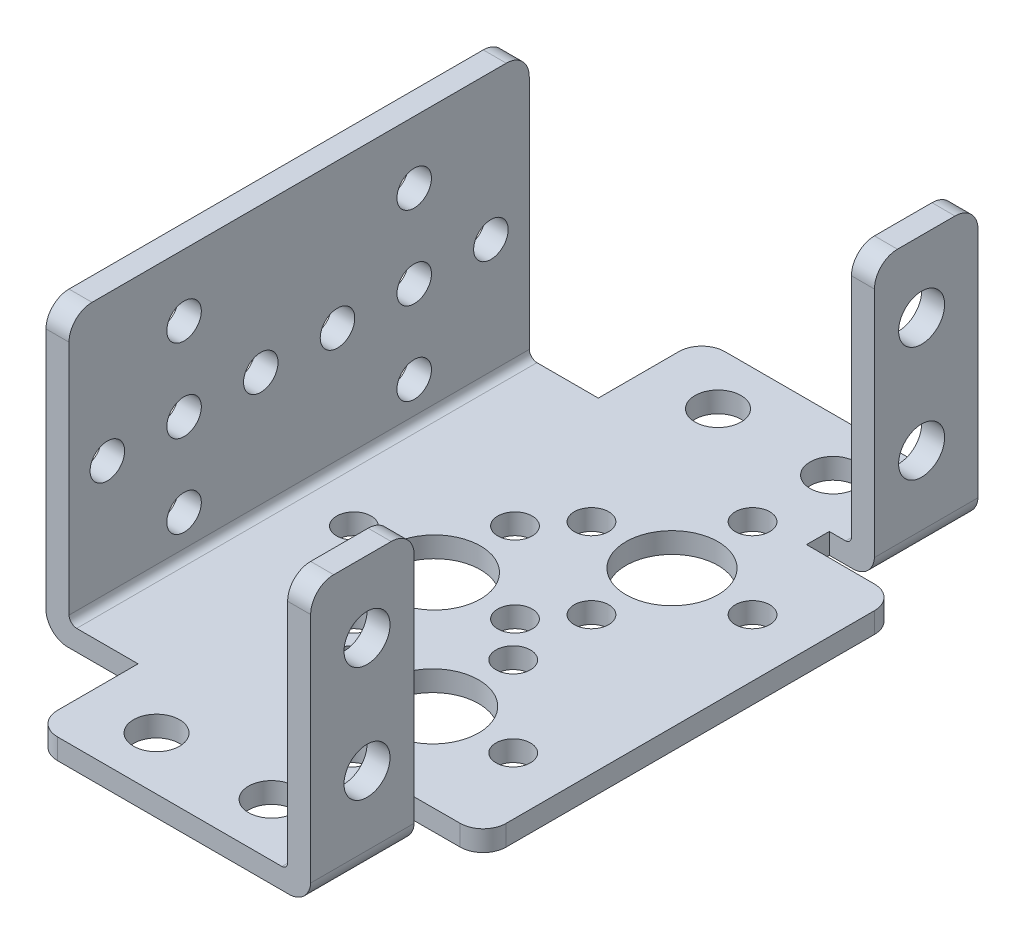
from build123d import *

# Parameters (mm, degrees)
BOSS_EXTRUDE1_DEPTH  = 40
FILLET1_R            = 2
BOSS_EXTRUDE2_DEPTH  = 9
FILLET2_R            = 2
CUT_EXTRUDE1_DEPTH   = 9
FILLET3_R            = 2
FILLET2_OF_MIRROR3_R = 2
FILLET3_OF_MIRROR3_R = 2
SKETCH5_R            = 1.5
CUT_EXTRUDE2_DEPTH   = 9
SKETCH7_R            = 2
CUT_EXTRUDE3_DEPTH   = 9
SKETCH8_R            = 2
CUT_EXTRUDE4_DEPTH   = 9
SKETCH9_R            = 4
SKETCH9_R_2          = 1.5
CUT_EXTRUDE5_DEPTH   = 9
SKETCH10_R           = 1.5
SKETCH10_R_2         = 4
CUT_EXTRUDE6_DEPTH   = 9


with BuildPart() as part:
    # Sketch2 → Boss-Extrude1 (new body)
    with BuildSketch(Plane.XY):
        with BuildLine():
            ThreePointArc((0, 1.792201759), (0.553343721, 0.553343721), (1.792201759, 0))
            Line((1.792201759, 0), (2, 0))
            Line((2, 0), (36, 0))
            Line((36, 0), (36, 1.792224077))
            Line((36, 1.792224077), (2.665691545, 1.792224077))
            ThreePointArc((2.665691545, 1.792224077), (2.206352155, 1.99856094), (2, 2.45789346))
            Line((2, 2.45789346), (2, 25))
            Line((2, 25), (0, 25))
            Line((0, 25), (0, 1.792201759))
        make_face()
    extrude(amount=BOSS_EXTRUDE1_DEPTH)

    # Fillet1
    fillet1_edges = [part.edges().sort_by_distance(p)[0] for p in [
        (36, 0.896112038, 0),
        (1, 25, 0),
        (1, 25, 40),
        (36, 0.896112038, 40),
    ]]
    fillet(fillet1_edges, radius=FILLET1_R)

    # Sketch3 → Boss-Extrude2 (add)
    with BuildSketch(Plane(origin=(0, 0, 0), x_dir=(-1, 0, 0), z_dir=(0, 0, -1))):
        with BuildLine():
            Line((-32, 1.792224077), (-29.505638958, 1.792224077))
            ThreePointArc((-29.505638958, 1.792224077), (-29.847420209, 1.944803868), (-30, 2.286585119))
            Line((-30, 2.286585119), (-30, 24))
            Line((-30, 24), (-32, 24))
            Line((-32, 24), (-32, 1.792224077))
        make_face()
        with BuildLine():
            Line((-8, 0), (-8, 1.792224077))
            Line((-8, 1.792224077), (-29.505638958, 1.792224077))
            Line((-29.505638958, 1.792224077), (-32, 1.792224077))
            ThreePointArc((-32, 1.792224077), (-31.446652567, 0.553347433), (-30.207775923, 0))
            Line((-30.207775923, 0), (-30, 0))
            Line((-30, 0), (-8, 0))
        make_face()
    boss_extrude2 = extrude(amount=BOSS_EXTRUDE2_DEPTH)

    # Fillet2
    fillet2_edges = [part.edges().sort_by_distance(p)[0] for p in [
        (8, 0.896112038, -9),
        (31, 24, -9),
        (31, 24, 0),
    ]]
    fillet(fillet2_edges, radius=FILLET2_R)

    # Sketch4 → Cut-Extrude1 (cut)
    with BuildSketch(Plane(origin=(0, 1.792224077, 0), x_dir=(1, 0, 0), z_dir=(0, 1, 0))):
        with BuildLine():
            Line((28.075602478, 0), (28.075602478, -1.97807902))
            Line((28.075602478, -1.97807902), (36, -2))
            ThreePointArc((36, -2), (35.415834928, -0.584165072), (34, 0))
            Line((34, 0), (28.075602478, 0))
        make_face()
    cut_extrude1 = extrude(amount=-CUT_EXTRUDE1_DEPTH, mode=Mode.SUBTRACT)

    # Fillet3
    fillet3_edges = [part.edges().sort_by_distance(p)[0] for p in [
        (36, 0.896112038, 2),
    ]]
    fillet(fillet3_edges, radius=FILLET3_R)

    # Mirror3: Boss-Extrude2, Cut-Extrude1 across plane
    add(boss_extrude2.mirror(Plane(origin=(0, 0, 20), x_dir=(1, 0, 0), z_dir=(0, 0, -1))))
    add(cut_extrude1.mirror(Plane(origin=(0, 0, 20), x_dir=(1, 0, 0), z_dir=(0, 0, -1))), mode=Mode.SUBTRACT)

    # Fillet2 of Mirror3
    fillet2_of_mirror3_edges = [part.edges().sort_by_distance(p)[0] for p in [
        (8, 0.896112038, 49),
        (31, 24, 49),
        (31, 24, 40),
    ]]
    fillet(fillet2_of_mirror3_edges, radius=FILLET2_OF_MIRROR3_R)

    # Fillet3 of Mirror3
    fillet3_of_mirror3_edges = [part.edges().sort_by_distance(p)[0] for p in [
        (36, 0.896112038, 38),
    ]]
    fillet(fillet3_of_mirror3_edges, radius=FILLET3_OF_MIRROR3_R)

    # Sketch5 → Cut-Extrude2 (cut)
    with BuildSketch(Plane.ZY):
        with Locations((36.666666667, 12.396100879)):
            Circle(SKETCH5_R)
        with Locations((30, 12.396100879)):
            Circle(SKETCH5_R)
        with Locations((23.333333333, 12.396100879)):
            Circle(SKETCH5_R)
        with Locations((16.666666667, 12.396100879)):
            Circle(SKETCH5_R)
        with Locations((10, 12.396100879)):
            Circle(SKETCH5_R)
        with Locations((3.333333333, 12.396100879)):
            Circle(SKETCH5_R)
        with Locations((30, 19.596100879)):
            Circle(SKETCH5_R)
        with Locations((30, 5.196100879)):
            Circle(SKETCH5_R)
        with Locations((10, 19.596100879)):
            Circle(SKETCH5_R)
        with Locations((10, 5.196100879)):
            Circle(SKETCH5_R)
    extrude(amount=-CUT_EXTRUDE2_DEPTH, mode=Mode.SUBTRACT)

    # Sketch7 → Cut-Extrude3 (cut)
    with BuildSketch(Plane(origin=(0, 1.792224077, 0), x_dir=(1, 0, 0), z_dir=(0, 1, 0))):
        with Locations(Location((24.005638958, -44.4, 0), (0, 0, 270))):
            Circle(SKETCH7_R)
        with Locations(Location((14.005638958, -44.4, 0), (0, 0, 270))):
            Circle(SKETCH7_R)
    cut_extrude3 = extrude(amount=-CUT_EXTRUDE3_DEPTH, mode=Mode.SUBTRACT)

    # Mirror4: Cut-Extrude3 across plane
    add(cut_extrude3.mirror(Plane(origin=(0, 0, 20), x_dir=(1, 0, 0), z_dir=(0, 0, -1))), mode=Mode.SUBTRACT)

    # Sketch8 → Cut-Extrude4 (cut)
    with BuildSketch(Plane.ZY.offset(-30)):
        with Locations((44.1, 17.792224077)):
            Circle(SKETCH8_R)
        with Locations((44.1, 7.792224077)):
            Circle(SKETCH8_R)
    cut_extrude4 = extrude(amount=-CUT_EXTRUDE4_DEPTH, mode=Mode.SUBTRACT)

    # Mirror5: Cut-Extrude4 across plane
    add(cut_extrude4.mirror(Plane(origin=(0, 0, 20), x_dir=(1, 0, 0), z_dir=(0, 0, -1))), mode=Mode.SUBTRACT)

    # Sketch9 → Cut-Extrude5 (cut)
    with BuildSketch(Plane(origin=(0, 1.792224077, 0), x_dir=(1, 0, 0), z_dir=(0, 1, 0))):
        with Locations(Location((24.005638958, -9.6, 0), (0, 0, 270))):
            Circle(SKETCH9_R)
        with Locations(Location((24.005638958, -2.6, 0), (0, 0, 270))):
            Circle(SKETCH9_R_2)
        with Locations(Location((31.005638958, -9.6, 0), (0, 0, 270))):
            Circle(SKETCH9_R_2)
        with Locations(Location((24.005638958, -16.6, 0), (0, 0, 270))):
            Circle(SKETCH9_R_2)
        with Locations(Location((17.005638958, -9.6, 0), (0, 0, 270))):
            Circle(SKETCH9_R_2)
    cut_extrude5 = extrude(amount=-CUT_EXTRUDE5_DEPTH, mode=Mode.SUBTRACT)

    # Mirror6: Cut-Extrude5 across plane
    add(cut_extrude5.mirror(Plane(origin=(0, 0, 20), x_dir=(1, 0, 0), z_dir=(0, 0, -1))), mode=Mode.SUBTRACT)

    # Sketch10 → Cut-Extrude6 (cut)
    with BuildSketch(Plane(origin=(0, 1.792224077, 0), x_dir=(1, 0, 0), z_dir=(0, 1, 0))):
        with BuildLine():
            ThreePointArc((15.505638958, -13.245543245), (15.06629913, -12.184883073), (14.005638958, -11.745543245))
            Line((14.005638958, -11.745543245), (14.005638958, -14.745543245))
            ThreePointArc((14.005638958, -14.745543245), (15.06629913, -14.306203416), (15.505638958, -13.245543245))
        make_face()
        with BuildLine():
            Line((14.005638958, -14.745543245), (14.005638958, -11.745543245))
            ThreePointArc((14.005638958, -11.745543245), (12.505638958, -13.245543245), (14.005638958, -14.745543245))
        make_face()
        with Locations(Location((7.005638958, -20.245543245, 0), (0, 0, 270))):
            Circle(SKETCH10_R)
        with Locations(Location((21.005638958, -20.245543245, 0), (0, 0, 270))):
            Circle(SKETCH10_R)
        with Locations(Location((14.005638958, -27.245543245, 0), (0, 0, 270))):
            Circle(SKETCH10_R)
        with Locations(Location((14.005638958, -20.245543245, 0), (0, 0, 270))):
            Circle(SKETCH10_R_2)
    extrude(amount=-CUT_EXTRUDE6_DEPTH, mode=Mode.SUBTRACT)


solid = part.part
